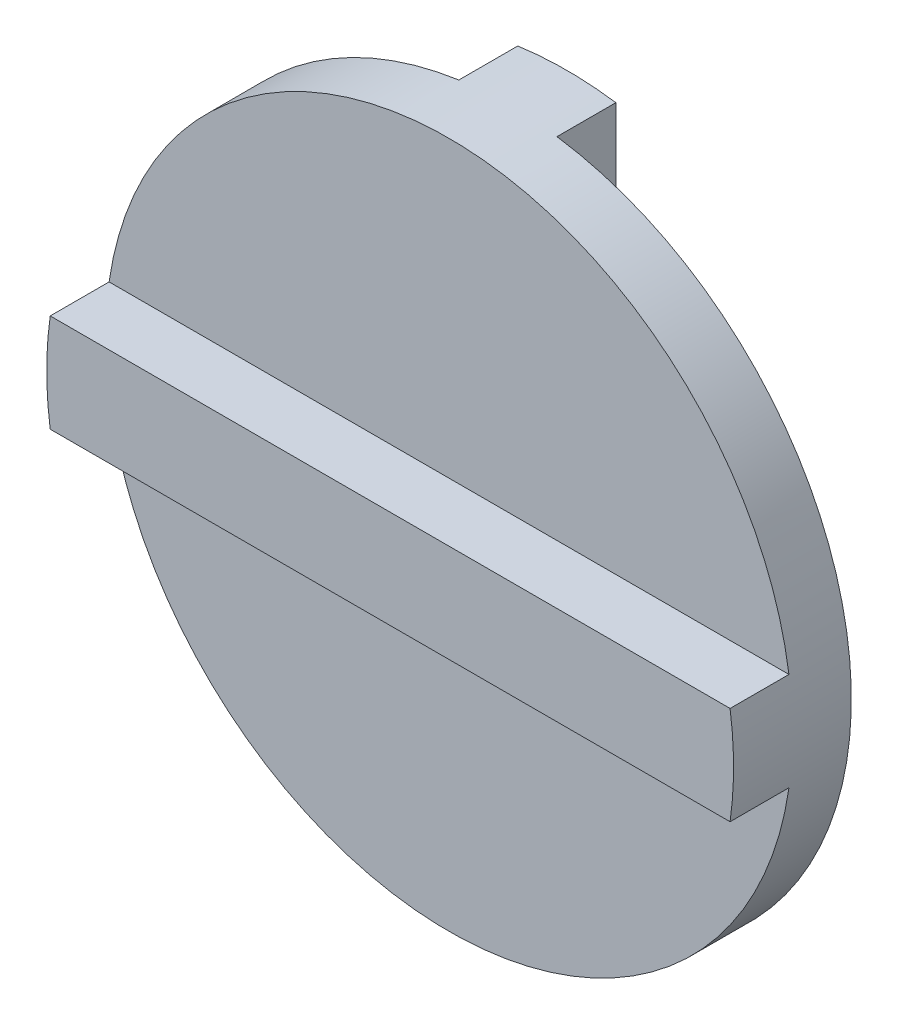
from build123d import *
from build123d.topology import SkipClean

# Parameters (mm, degrees)
SKETCH1_R           = 12.25
BOSS_EXTRUDE1_DEPTH = 1.05
BOSS_EXTRUDE2_START = 2.1
BOSS_EXTRUDE2_DEPTH = 2.1
BOSS_EXTRUDE3_DEPTH = 2.1


with BuildPart() as part:
    # Sketch1 → Boss-Extrude1 (new, symmetric)
    with BuildSketch(Plane.XY):
        Circle(SKETCH1_R)
    extrude(amount=BOSS_EXTRUDE1_DEPTH, both=True)

    # Sketch2 → Boss-Extrude2 (add)
    with SkipClean():  # the faces are left unmerged after this step: merging them gives an invalid solid
        with BuildSketch(Plane.XY.offset(1.05).offset(BOSS_EXTRUDE2_START)):
            with BuildLine():
                Line((-12.124355653, 1.75), (12.124355653, 1.75))
                ThreePointArc((12.124355653, 1.75), (12.25, 0), (12.124355653, -1.75))
                Line((12.124355653, -1.75), (-12.124355653, -1.75))
                ThreePointArc((-12.124355653, -1.75), (-12.25, 0), (-12.124355653, 1.75))
            make_face()
        extrude(amount=-BOSS_EXTRUDE2_DEPTH)

    # Sketch3 → Boss-Extrude3 (add)
    with SkipClean():  # the faces are left unmerged after this step: merging them gives an invalid solid
        with BuildSketch(Plane(origin=(0, 0, -1.05), x_dir=(-1, 0, 0), z_dir=(0, 0, -1))):
            with BuildLine():
                Line((-1.75, -12.124355653), (-1.75, 12.124355653))
                ThreePointArc((-1.75, 12.124355653), (0, 12.25), (1.75, 12.124355653))
                Line((1.75, 12.124355653), (1.75, -12.124355653))
                ThreePointArc((1.75, -12.124355653), (0, -12.25), (-1.75, -12.124355653))
            make_face()
        extrude(amount=BOSS_EXTRUDE3_DEPTH)


solid = part.part
